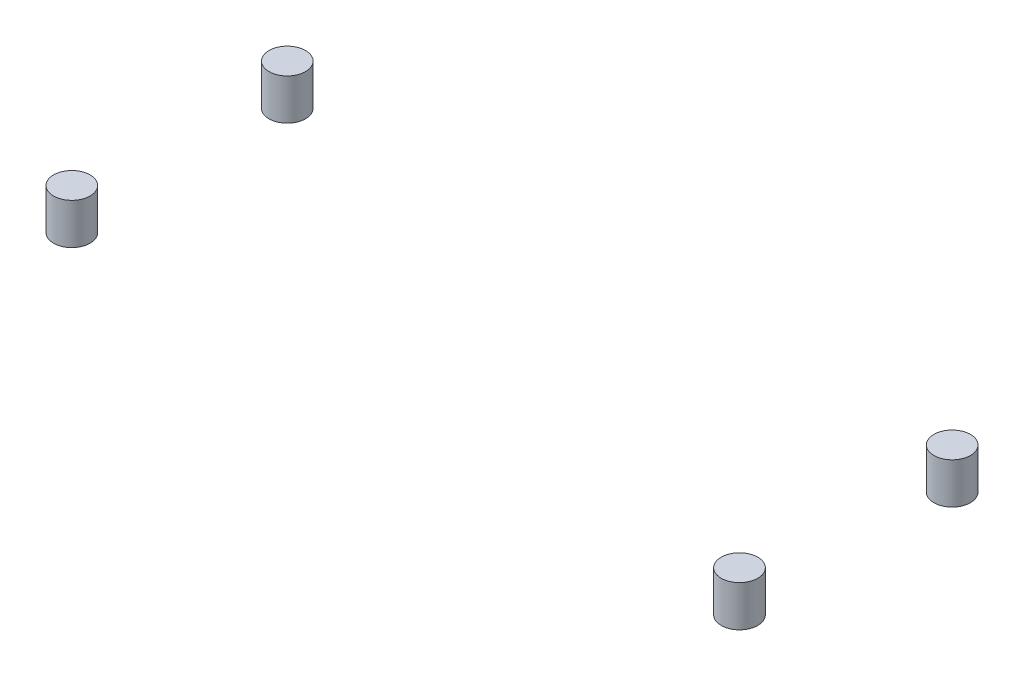
from build123d import *

# Parameters (mm, degrees)
SKETCH1_R             = 2.5
BOSS_EXTRUDE1_DEPTH   = 5.6
BOSS_EXTRUDE1_2_DEPTH = 5.6
BOSS_EXTRUDE1_3_DEPTH = 5.6
BOSS_EXTRUDE1_4_DEPTH = 5.6


with BuildPart() as part:
    # Sketch1 → Boss-Extrude1 (new body)
    with BuildSketch(Plane(origin=(0, 118.172945129, -8.6e-08), x_dir=(1, 0, 0), z_dir=(0, 1.0, -7.252377726141292e-10))):
        with Locations(Location((152.201551007, -98.67514808, 0), (0, 0, 270))):
            Circle(SKETCH1_R)
    extrude(amount=BOSS_EXTRUDE1_DEPTH)


with BuildPart() as body_2:
    # Sketch1 → Boss-Extrude1 2 (new body)
    with BuildSketch(Plane(origin=(0, 118.172945129, -8.6e-08), x_dir=(1, 0, 0), z_dir=(0, 1.0, -7.252377726141292e-10))):
        with Locations(Location((61.269551007, -98.67514808, 0), (0, 0, 270))):
            Circle(SKETCH1_R)
    extrude(amount=BOSS_EXTRUDE1_2_DEPTH)


with BuildPart() as body_3:
    # Sketch1 → Boss-Extrude1 3 (new body)
    with BuildSketch(Plane(origin=(0, 118.172945129, -8.6e-08), x_dir=(1, 0, 0), z_dir=(0, 1.0, -7.252377726141292e-10))):
        with Locations(Location((61.269551007, -128.13914808, 0), (0, 0, 270))):
            Circle(SKETCH1_R)
    extrude(amount=BOSS_EXTRUDE1_3_DEPTH)


with BuildPart() as body_4:
    # Sketch1 → Boss-Extrude1 4 (new body)
    with BuildSketch(Plane(origin=(0, 118.172945129, -8.6e-08), x_dir=(1, 0, 0), z_dir=(0, 1.0, -7.252377726141292e-10))):
        with Locations(Location((152.201551007, -127.75814808, 0), (0, 0, 270))):
            Circle(SKETCH1_R)
    extrude(amount=BOSS_EXTRUDE1_4_DEPTH)


solid = Compound([part.part, body_2.part, body_3.part, body_4.part])
